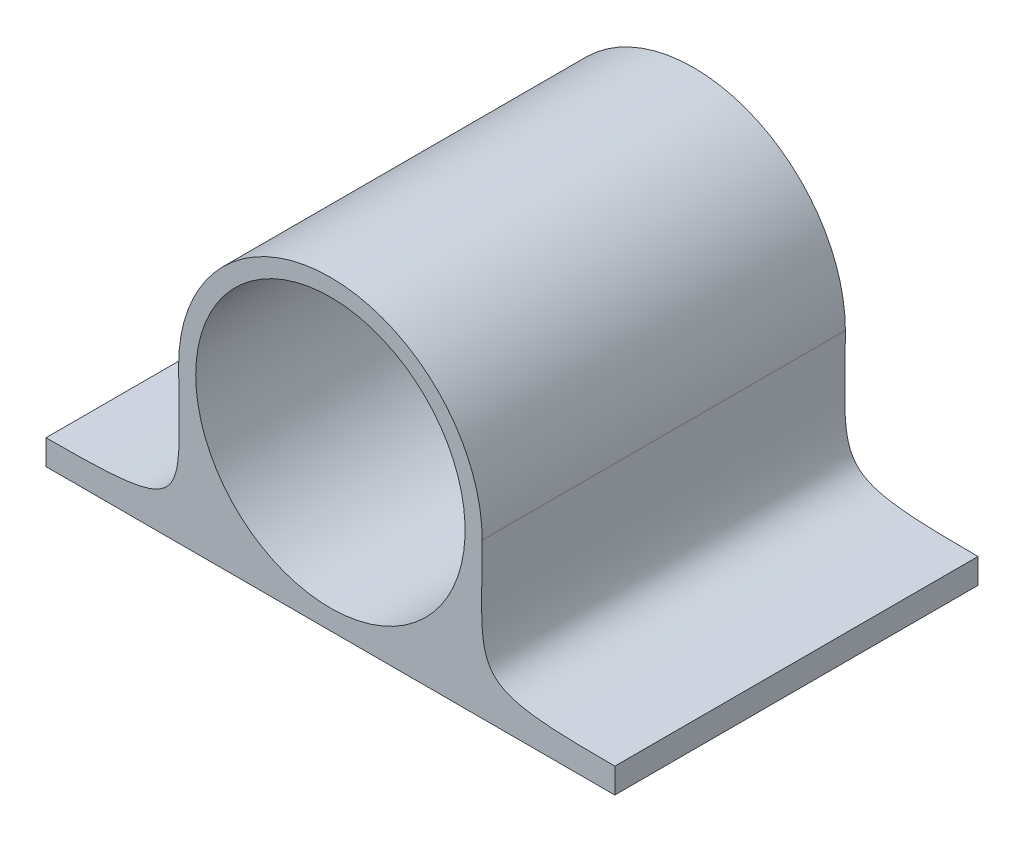
from build123d import *

# Parameters (mm, degrees)
SKETCH1_R           = 21.51
BOSS_EXTRUDE1_DEPTH = 58
SKETCH1_4_R         = 21.51
BOSS_EXTRUDE2_DEPTH = 3


with BuildPart() as part:
    # Sketch1 → Boss-Extrude1 (new body)
    with BuildSketch(Plane.XY):
        with BuildLine():
            Line((-45.421940828, -20.666245921), (-45.421940828, -24.666245921))
            Line((-45.421940828, -24.666245921), (45.421940828, -24.666245921))
            Line((45.421940828, -24.666245921), (45.421940828, -20.666245921))
            add(Edge.make_bspline(
                [(45.421940828, -20.666245921), (21.532203305, -20.666245921), (24.241475666, -19.078845964), (24.241475666, 0)],
                knots=[0, 0, 0, 0, 1, 1, 1, 1], degree=3))
            ThreePointArc((24.241475666, 0), (0, 24.241475666), (-24.241475666, 0))
            add(Edge.make_bspline(
                [(-45.421940828, -20.666245921), (-21.532203305, -20.666245921), (-24.241475666, -19.078845964), (-24.241475666, 0)],
                knots=[0, 0, 0, 0, 1, 1, 1, 1], degree=3))
        make_face()
        Circle(SKETCH1_R, mode=Mode.SUBTRACT)
    extrude(amount=BOSS_EXTRUDE1_DEPTH)

    # Sketch1<4> → Boss-Extrude2 (add)
    with BuildSketch(Plane.XY):
        Circle(SKETCH1_4_R)
        with BuildLine():
            ThreePointArc((0, -5.15), (-3.641599923, 3.641599923), (5.15, 0))
            ThreePointArc((5.15, 0), (3.641599923, -3.641599923), (0, -5.15))
        make_face(mode=Mode.SUBTRACT)
    extrude(amount=BOSS_EXTRUDE2_DEPTH)


solid = part.part
